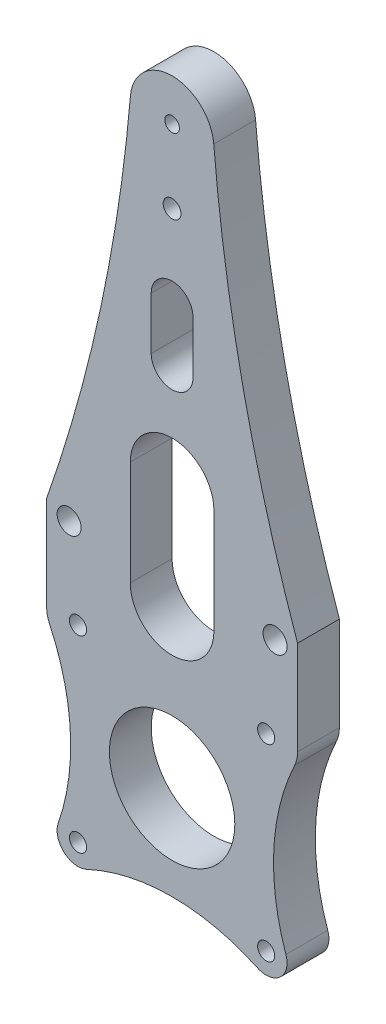
from build123d import *

# Parameters (mm, degrees)
ESQUISSE1_R             = 4.1
ESQUISSE1_R_2           = 5.75
BOSS_EXTRU_1_DEPTH      = 20
ESQUISSE2_R             = 30
ENL_V_MAT_EXTRU_1_DEPTH = 20
ENL_V_MAT_EXTRU_2_DEPTH = 20
ENL_V_MAT_EXTRU_3_DEPTH = 20
ESQUISSE5_R             = 4.25
ENL_V_MAT_EXTRU_4_DEPTH = 20
TROU_TARAUD_M8X1_01_D   = 7


with BuildPart() as part:
    # Esquisse1 → Boss.-Extru.1 (new body)
    with BuildSketch(Plane.XY):
        with BuildLine():
            Line((0, 0), (0, -340))
            ThreePointArc((0, -340), (-20.879556565, -342.291995457), (-40.764705882, -349.058823529))
            ThreePointArc((-40.764705882, -349.058823529), (-51.70200076, -347.421804754), (-54.442463892, -336.707603359))
            ThreePointArc((-54.442463892, -336.707603359), (-48.641150346, -296.132285263), (-58.581232197, -256.367898556))
            ThreePointArc((-58.581232197, -256.367898556), (-59.641012311, -253.262017554), (-60, -250))
            Line((-60, -250), (-60, -205))
            ThreePointArc((-60, -205), (-34.0967157, -112.901065178), (-19.926246382, -18.283985684))
            ThreePointArc((-19.926246382, -18.283985684), (-13.521828901, -5.263645527), (0, 0))
        make_face()
        with Locations((-45, -340)):
            Circle(ESQUISSE1_R, mode=Mode.SUBTRACT)
        with Locations((-45, -250)):
            Circle(ESQUISSE1_R, mode=Mode.SUBTRACT)
        with Locations((-49.25, -209)):
            Circle(ESQUISSE1_R_2, mode=Mode.SUBTRACT)
    boss_extru_1 = extrude(amount=BOSS_EXTRU_1_DEPTH)

    # Symétrie1: Boss.-Extru.1 across plane
    add(boss_extru_1.mirror(Plane(origin=(0, 0, 20), x_dir=(0, 0, 1), z_dir=(-1, 0, 0))))

    # Esquisse2 → Enlèv. mat.-Extru.1 (cut)
    with BuildSketch(Plane.XY.offset(20)):
        with Locations((0, -295)):
            Circle(ESQUISSE2_R)
    extrude(amount=-ENL_V_MAT_EXTRU_1_DEPTH, mode=Mode.SUBTRACT)

    # Esquisse3 → Enlèv. mat.-Extru.2 (cut)
    with BuildSketch(Plane.XY.offset(20)):
        with BuildLine():
            Line((-20, -220), (-20, -170))
            ThreePointArc((-20, -170), (0, -150), (20, -170))
            Line((20, -170), (20, -220))
            ThreePointArc((20, -220), (0, -240), (-20, -220))
        make_face()
    extrude(amount=-ENL_V_MAT_EXTRU_2_DEPTH, mode=Mode.SUBTRACT)

    # Esquisse4 → Enlèv. mat.-Extru.3 (cut)
    with BuildSketch(Plane.XY.offset(20)):
        with BuildLine():
            Line((-10, -120), (-10, -95))
            ThreePointArc((-10, -95), (0, -85), (10, -95))
            Line((10, -95), (10, -120))
            ThreePointArc((10, -120), (0, -130), (-10, -120))
        make_face()
    extrude(amount=-ENL_V_MAT_EXTRU_3_DEPTH, mode=Mode.SUBTRACT)

    # Esquisse5 → Enlèv. mat.-Extru.4 (cut)
    with BuildSketch(Plane.XY.offset(20)):
        with Locations((0, -55)):
            Circle(ESQUISSE5_R)
    extrude(amount=-ENL_V_MAT_EXTRU_4_DEPTH, mode=Mode.SUBTRACT)

    # Trou taraudé M8x1.01 (through all)
    with Locations(Plane.XY.offset(20)):
        with Locations((0, -20)):
            Hole(TROU_TARAUD_M8X1_01_D / 2)


solid = part.part
